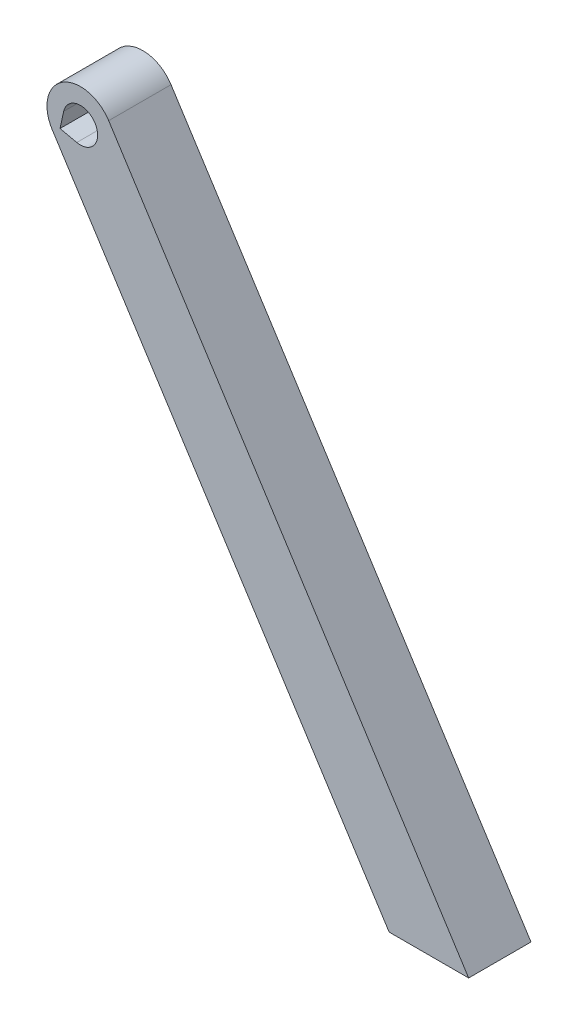
from build123d import *

# Parameters (mm, degrees)
SALIENTE_EXTRUIR1_DEPTH = 6.9


with BuildPart() as part:
    # Croquis1 → Saliente-Extruir1 (new body)
    with BuildSketch(Plane.XY):
        with BuildLine():
            Line((-74.243930555, 54.648970741), (-34.403574409, -7.603291729))
            Line((-34.403574409, -7.603291729), (-43.204784385, -7.603291729))
            Line((-43.204784385, -7.603291729), (-80.487794166, 50.653007541))
            ThreePointArc((-80.487794166, 50.653007541), (-79.363843961, 55.772920947), (-74.243930555, 54.648970741))
        make_face()
        with BuildLine():
            Line((-79.629068495, 51.202576909), (-79.221671544, 53.058386092))
            ThreePointArc((-79.221671544, 53.058386092), (-75.765533956, 53.675171252), (-77.773259312, 50.795179958))
            Line((-77.773259312, 50.795179958), (-79.629068495, 51.202576909))
        make_face(mode=Mode.SUBTRACT)
    extrude(amount=SALIENTE_EXTRUIR1_DEPTH)


solid = part.part
